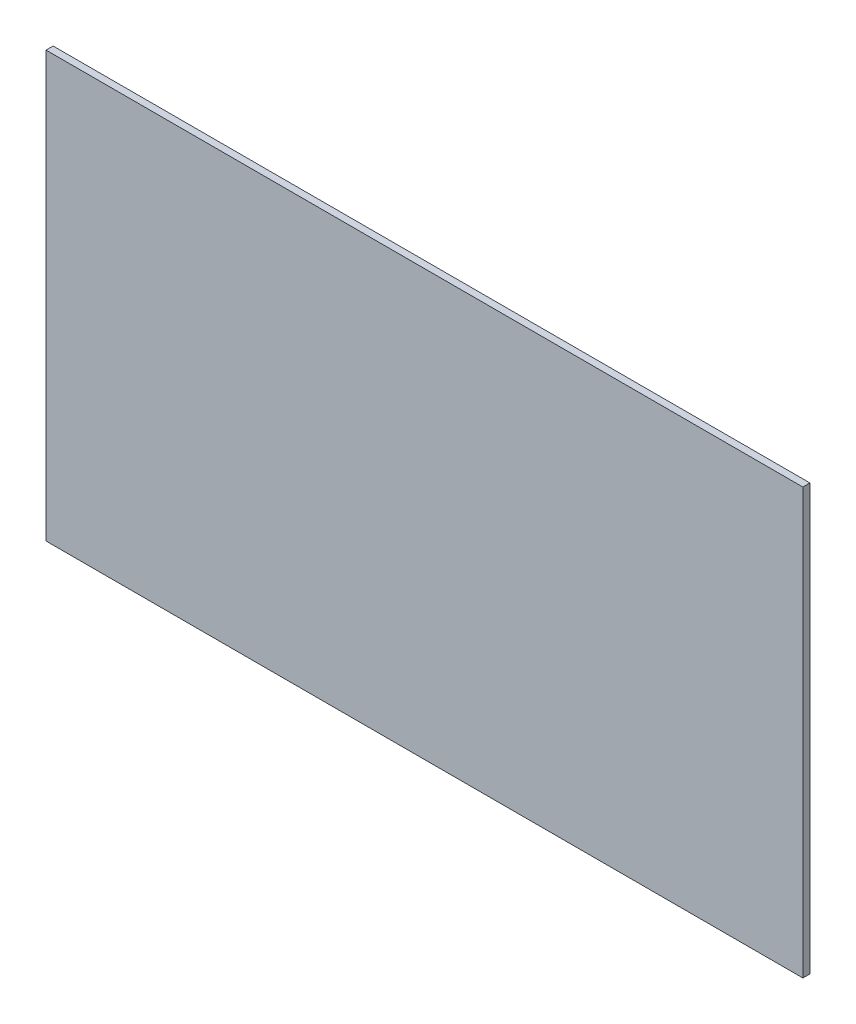
from build123d import *

# Parameters (mm, degrees)
SKETCH_1_W      = 534
SKETCH_1_H      = 300
EXTRUDE_1_DEPTH = 5


with BuildPart() as part:
    # 草圖1 → 填料-伸長1 (new body)
    with BuildSketch(Plane.XY):
        Rectangle(SKETCH_1_W, SKETCH_1_H)
    extrude(amount=EXTRUDE_1_DEPTH)


solid = part.part
